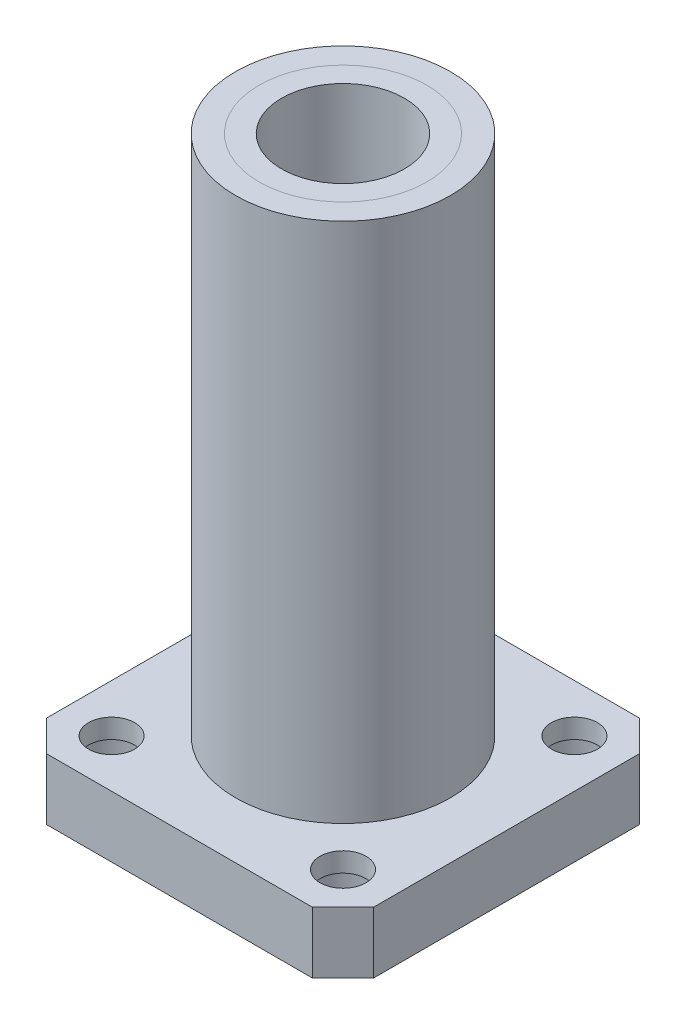
from build123d import *

# Parameters (mm, degrees)
SKETCH1_R           = 10.5
SKETCH1_R_2         = 6
BOSS_EXTRUDE1_DEPTH = 57
SKETCH2_W           = 32
SKETCH2_H           = 32
SKETCH2_R           = 6
BOSS_EXTRUDE2_DEPTH = 6
SKETCH3_R           = 2.25
CUT_EXTRUDE1_DEPTH  = 62.326992426
CHAMFER1_SIZE       = 3
SKETCH5_R           = 3.75
CUT_EXTRUDE2_DEPTH  = 4.1


with BuildPart() as part:
    # Sketch1 → Boss-Extrude1 (new body)
    with BuildSketch(Plane(origin=(0, 0, 0), x_dir=(1, 0, 0), z_dir=(0, 1, 0))):
        with Locations(Location((0, 0, 0), (0, 0, 90))):
            Circle(SKETCH1_R)
        with Locations(Location((0, 0, 0), (0, 0, 90))):
            Circle(SKETCH1_R_2, mode=Mode.SUBTRACT)
    extrude(amount=BOSS_EXTRUDE1_DEPTH)

    # Sketch2 → Boss-Extrude2 (add)
    with BuildSketch(Plane(origin=(0, 0, 0), x_dir=(1, 0, 0), z_dir=(0, 1, 0))):
        Rectangle(SKETCH2_W, SKETCH2_H)
        with Locations(Location((0, 0, 0), (0, 0, 90))):
            Circle(SKETCH2_R, mode=Mode.SUBTRACT)
    extrude(amount=BOSS_EXTRUDE2_DEPTH)

    # Sketch3 → Cut-Extrude1 (cut, through all)
    with BuildSketch(Plane(origin=(0, 0, 0), x_dir=(1, 0, 0), z_dir=(0, 1, 0))):
        with Locations(Location((-11.313708499, 11.313708499, 0), (0, 0, 90))):
            Circle(SKETCH3_R)
        with Locations(Location((-11.313708499, -11.313708499, 0), (0, 0, 90))):
            Circle(SKETCH3_R)
        with Locations(Location((11.313708499, -11.313708499, 0), (0, 0, 90))):
            Circle(SKETCH3_R)
        with Locations(Location((11.313708499, 11.313708499, 0), (0, 0, 90))):
            Circle(SKETCH3_R)
    extrude(amount=CUT_EXTRUDE1_DEPTH, mode=Mode.SUBTRACT)

    # Chamfer1
    chamfer1_edges = [part.edges().sort_by_distance(p)[0] for p in [
        (16, 3, 16),
        (16, 3, -16),
        (-16, 3, -16),
        (-16, 3, 16),
    ]]
    chamfer(chamfer1_edges, length=CHAMFER1_SIZE)

    # Sketch5 → Cut-Extrude2 (cut)
    with BuildSketch(Plane.XZ):
        with Locations(Location((-11.313708499, 11.313708499, 0), (0, 0, 270))):
            Circle(SKETCH5_R)
        with Locations(Location((11.313708499, 11.313708499, 0), (0, 0, 270))):
            Circle(SKETCH5_R)
        with Locations(Location((11.313708499, -11.313708499, 0), (0, 0, 270))):
            Circle(SKETCH5_R)
        with Locations(Location((-11.313708499, -11.313708499, 0), (0, 0, 270))):
            Circle(SKETCH5_R)
    extrude(amount=-CUT_EXTRUDE2_DEPTH, mode=Mode.SUBTRACT)


solid = part.part
